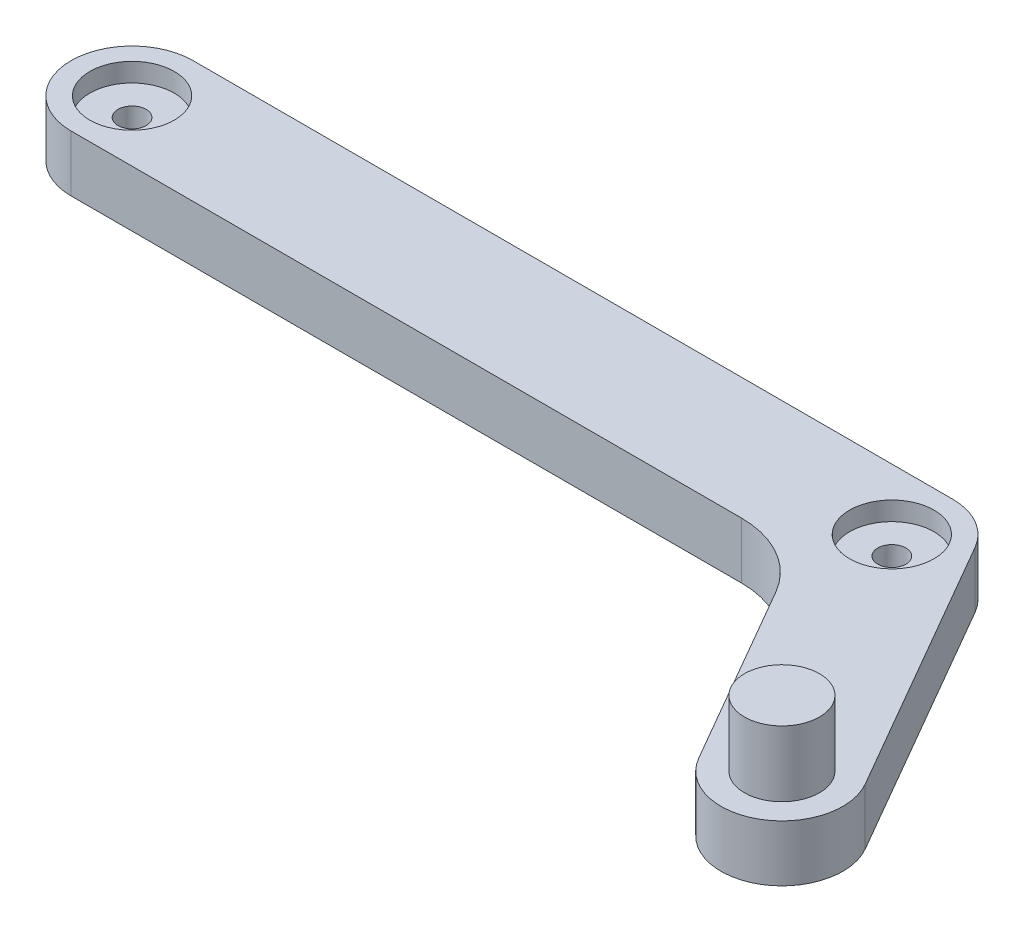
from build123d import *

# Parameters (mm, degrees)
SKETCH1_R           = 1.5
BOSS_EXTRUDE1_DEPTH = 6
SKETCH2_R           = 4.5
CUT_EXTRUDE1_DEPTH  = 2
SKETCH3_R           = 4
BOSS_EXTRUDE2_DEPTH = 7


with BuildPart() as part:
    # Sketch1 → Boss-Extrude1 (new body)
    with BuildSketch(Plane(origin=(0, 0, 0), x_dir=(1, 0, 0), z_dir=(0, 1, 0))):
        with BuildLine():
            Line((0, 6.5), (81, 6.5))
            ThreePointArc((81, 6.5), (84.25, 5.629165125), (86.629165125, 3.25))
            Line((86.629165125, 3.25), (102.629165125, -24.462812921))
            ThreePointArc((102.629165125, -24.462812921), (100.25, -33.341978046), (91.370834875, -30.962812921))
            Line((91.370834875, -30.962812921), (80.133974596, -11.5))
            ThreePointArc((80.133974596, -11.5), (76.473720558, -7.839745962), (71.473720558, -6.5))
            Line((71.473720558, -6.5), (0, -6.5))
            ThreePointArc((0, -6.5), (-6.5, 0), (0, 6.5))
        make_face()
        with Locations(Location((0, 0, 0), (0, 0, 270))):
            Circle(SKETCH1_R, mode=Mode.SUBTRACT)
        with Locations(Location((81, 0, 0), (0, 0, 270))):
            Circle(SKETCH1_R, mode=Mode.SUBTRACT)
    extrude(amount=BOSS_EXTRUDE1_DEPTH)

    # Sketch2 → Cut-Extrude1 (cut)
    with BuildSketch(Plane(origin=(0, 6, 0), x_dir=(1, 0, 0), z_dir=(0, 1, 0))):
        with Locations(Location((0, 0, 0), (0, 0, 270))):
            Circle(SKETCH2_R)
        with Locations(Location((81, 0, 0), (0, 0, 270))):
            Circle(SKETCH2_R)
    extrude(amount=-CUT_EXTRUDE1_DEPTH, mode=Mode.SUBTRACT)

    # Sketch3 → Boss-Extrude2 (add)
    with BuildSketch(Plane(origin=(0, 6, 0), x_dir=(1, 0, 0), z_dir=(0, 1, 0))):
        with Locations(Location((97, -27.712812921, 0), (0, 0, 270))):
            Circle(SKETCH3_R)
    extrude(amount=BOSS_EXTRUDE2_DEPTH)


solid = part.part
